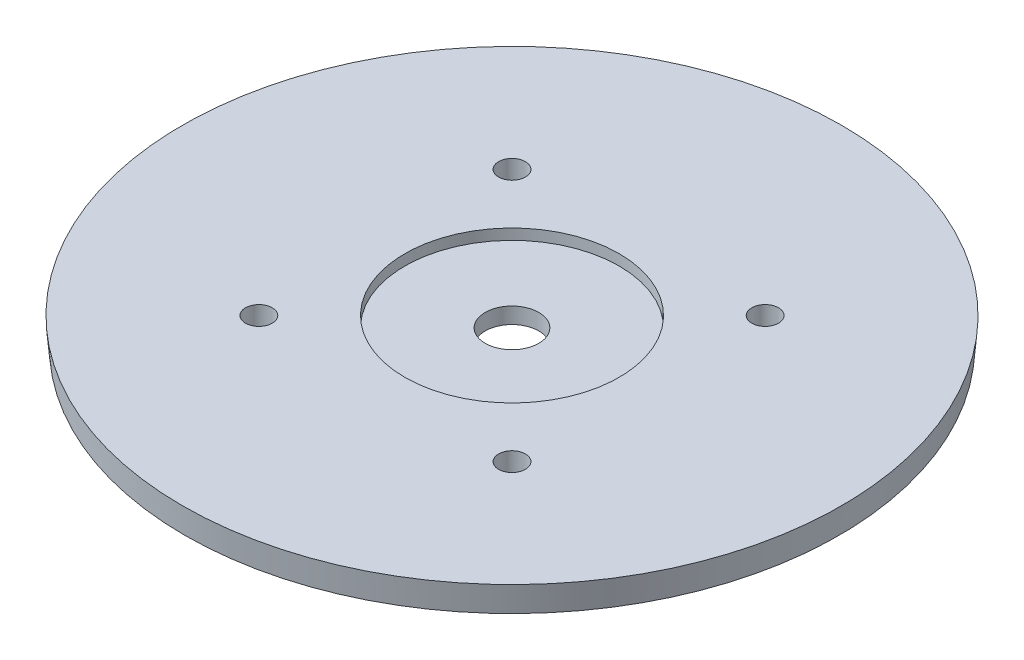
from build123d import *

# Parameters (mm, degrees)
SKETCH1_R           = 61.5
BOSS_EXTRUDE1_DEPTH = 5
BOSS_EXTRUDE1_DRAFT = -5
SKETCH2_R           = 2.5
SKETCH2_R_2         = 5
CUT_EXTRUDE2_DEPTH  = 88.117736426
SKETCH3_R           = 20
CUT_EXTRUDE3_DEPTH  = 2


with BuildPart() as part:
    # Sketch1 → Boss-Extrude1 (with draft: the straight prism first)
    with BuildSketch(Plane(origin=(0, 0, 0), x_dir=(1, 0, 0), z_dir=(0, 1, 0))):
        Circle(SKETCH1_R)
    extrude(amount=-BOSS_EXTRUDE1_DEPTH)
    # Boss-Extrude1: the draft: its side faces are tilted about the plane it starts from
    boss_extrude1_sides = [part.faces().sort_by_distance(p)[0] for p in [
        (-61.5, -2.5, 0),
    ]]
    draft(boss_extrude1_sides, Plane(origin=(0, 0, 0), x_dir=(1, 0, 0), z_dir=(0, 1, 0)), BOSS_EXTRUDE1_DRAFT)

    # Sketch2 → Cut-Extrude2 (cut, through all)
    with BuildSketch(Plane(origin=(0, 0, 0), x_dir=(1, 0, 0), z_dir=(0, 1, 0))):
        with Locations(Location((23.62, 23.62, 0), (0, 0, 270))):
            Circle(SKETCH2_R)
        with Locations(Location((23.62, -23.62, 0), (0, 0, 270))):
            Circle(SKETCH2_R)
        with Locations(Location((-23.62, -23.62, 0), (0, 0, 270))):
            Circle(SKETCH2_R)
        with Locations(Location((-23.62, 23.62, 0), (0, 0, 270))):
            Circle(SKETCH2_R)
        with Locations(Location((0, 0, 0), (0, 0, 270))):
            Circle(SKETCH2_R_2)
    extrude(amount=-CUT_EXTRUDE2_DEPTH, mode=Mode.SUBTRACT)

    # Sketch3 → Cut-Extrude3 (cut)
    with BuildSketch(Plane(origin=(0, 0, 0), x_dir=(1, 0, 0), z_dir=(0, 1, 0))):
        with Locations(Location((0, 0, 0), (0, 0, 270))):
            Circle(SKETCH3_R)
    extrude(amount=-CUT_EXTRUDE3_DEPTH, mode=Mode.SUBTRACT)


solid = part.part
